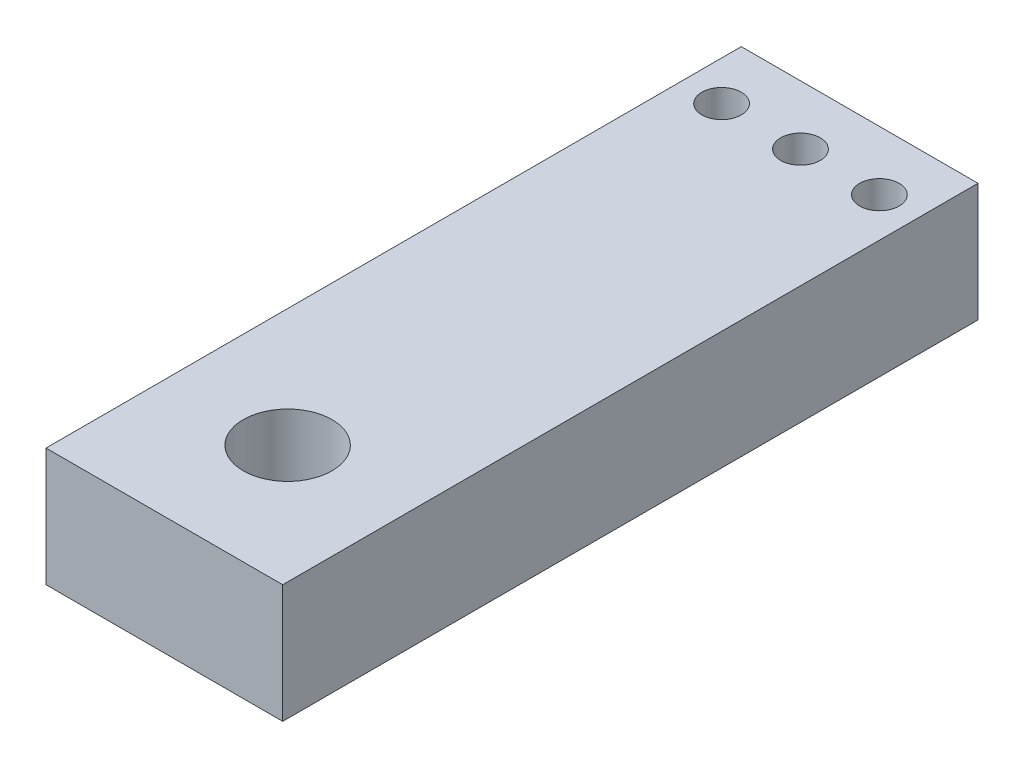
from build123d import *

# Parameters (mm, degrees)
SKETCH1_W           = 12
SKETCH1_H           = 35.25
BOSS_EXTRUDE1_DEPTH = 6
SKETCH2_R           = 1
SKETCH2_R_2         = 2.25
CUT_EXTRUDE1_DEPTH  = 38.716872882


with BuildPart() as part:
    # Sketch1 → Boss-Extrude1 (new body)
    with BuildSketch(Plane(origin=(0, 0, 0), x_dir=(1, 0, 0), z_dir=(0, 1, 0))):
        with Locations((6, 17.625)):
            Rectangle(SKETCH1_W, SKETCH1_H)
    extrude(amount=BOSS_EXTRUDE1_DEPTH)

    # Sketch2 → Cut-Extrude1 (cut, through all)
    with BuildSketch(Plane(origin=(0, 6, 0), x_dir=(1, 0, 0), z_dir=(0, 1, 0))):
        with Locations(Location((10, 32.25, 0), (0, 0, 270))):
            Circle(SKETCH2_R)
        with Locations(Location((6, 6.25, 0), (0, 0, 270))):
            Circle(SKETCH2_R_2)
        with Locations(Location((2, 32.25, 0), (0, 0, 270))):
            Circle(SKETCH2_R)
        with Locations(Location((6, 32.25, 0), (0, 0, 270))):
            Circle(SKETCH2_R)
    extrude(amount=-CUT_EXTRUDE1_DEPTH, mode=Mode.SUBTRACT)


solid = part.part
